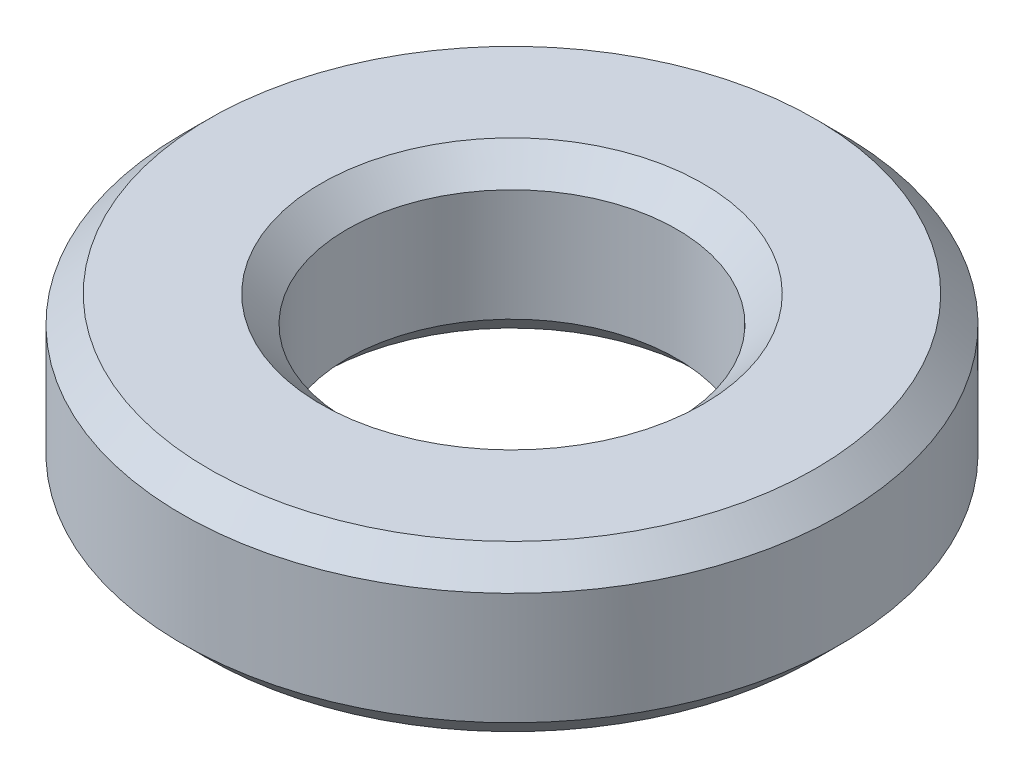
from build123d import *

# Parameters (mm, degrees)
SKETCH1_W     = 1.5875
SKETCH1_H     = 1.5875
CHAMFER1_SIZE = 0.254


with BuildPart() as part:
    # Sketch1 → Revolve1 (revolve)
    with BuildSketch(Plane.XY, mode=Mode.PRIVATE) as revolve1_sk:
        with Locations((2.38125, 0)):
            Rectangle(SKETCH1_W, SKETCH1_H)
    revolve(revolve1_sk.sketch.rotate(Axis((0, 1.644566993, 0), (0, -1, 0)), 180), axis=Axis((0, 1.644566993, 0), (0, -1, 0)))

    # Chamfer1
    chamfer1_edges = [part.edges().sort_by_distance(p)[0] for p in [
        (3.175, -0.79375, 0),
        (3.175, 0.79375, 0),
        (1.5875, 0.79375, 0),
        (1.5875, -0.79375, 0),
    ]]
    chamfer(chamfer1_edges, length=CHAMFER1_SIZE)


solid = part.part
